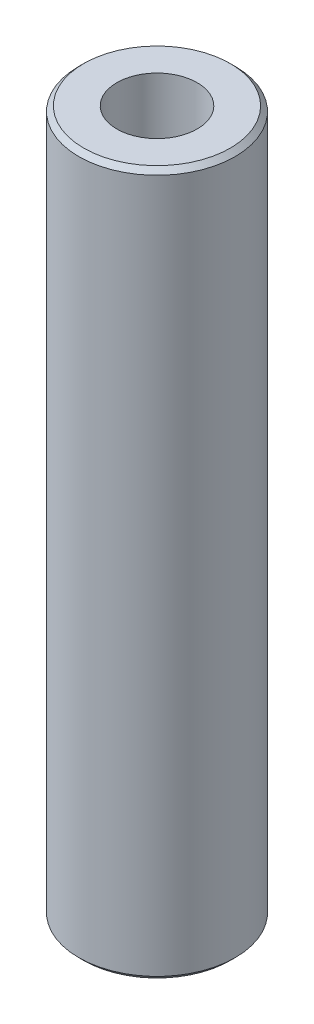
from build123d import *

# Parameters (mm, degrees)
CROQUIS2_R                = 6.35
SALIENTE_EXTRUIR1_DEPTH   = 28.575
CHAFL_N1_SIZE             = 0.396875
CLEARANCE_HOLE_DEPTH      = 30.952890094
CLEARANCE_HOLE_DEPTH_BACK = 30.952890094
CROQUIS4_R                = 3.2639


with BuildPart() as part:
    # Croquis2 → Saliente-Extruir1 (new, symmetric)
    with BuildSketch(Plane(origin=(0, 0, 0), x_dir=(1, 0, 0), z_dir=(0, 1, 0))):
        Circle(CROQUIS2_R)
    extrude(amount=SALIENTE_EXTRUIR1_DEPTH, both=True)

    # Chaflán1
    chafl_n1_edges = [part.edges().sort_by_distance(p)[0] for p in [
        (-6.35, -28.575, 0),
        (-6.35, 28.575, 0),
    ]]
    chamfer(chafl_n1_edges, length=CHAFL_N1_SIZE)

    # Croquis4 → Clearance Hole (cut, two sides: drawn at the far end of the back side and taken through both)
    with BuildSketch(Plane(origin=(0, 0, 0), x_dir=(1, 0, 0), z_dir=(0, 1, 0)).offset(-CLEARANCE_HOLE_DEPTH_BACK)):
        Circle(CROQUIS4_R)
    extrude(amount=CLEARANCE_HOLE_DEPTH + CLEARANCE_HOLE_DEPTH_BACK, mode=Mode.SUBTRACT)


solid = part.part
